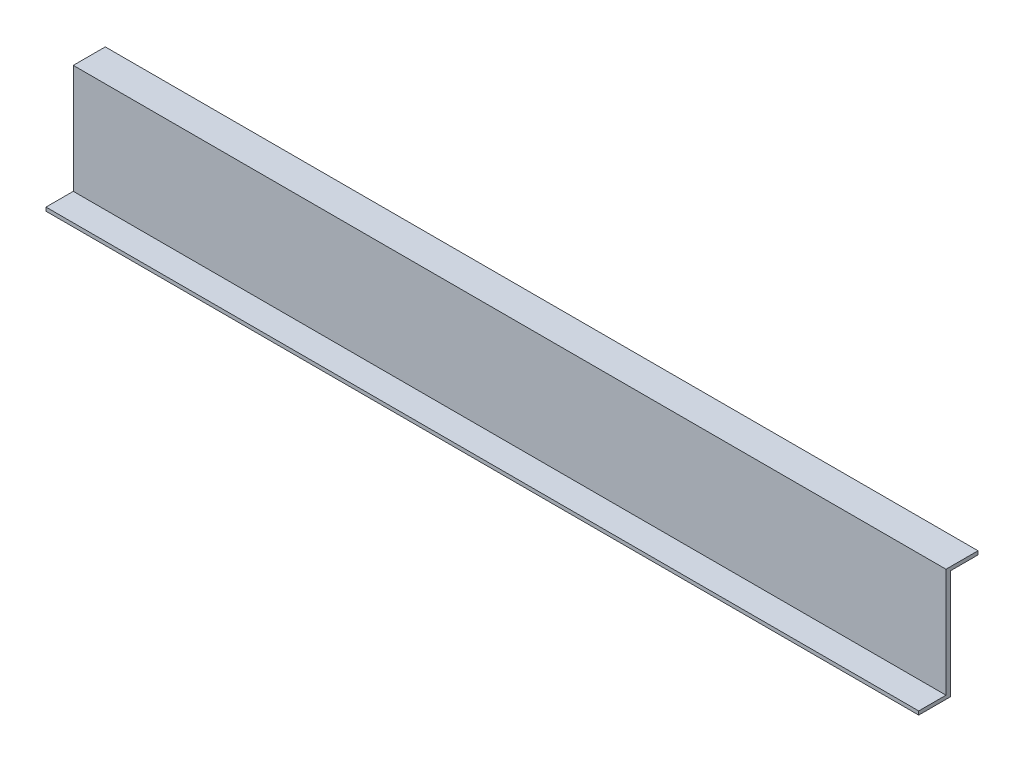
from build123d import *

# Parameters (mm, degrees)
SKETCH2_W           = 609.6
SKETCH2_H           = 78.74
BOSS_EXTRUDE1_DEPTH = 44.704
SKETCH4_W           = 19.05
SKETCH4_H           = 76.2
CUT_EXTRUDE1_DEPTH  = 617.287753583


with BuildPart() as part:
    # Sketch2 → Boss-Extrude1 (new body)
    with BuildSketch(Plane.XY):
        with Locations((304.8, 39.37)):
            Rectangle(SKETCH2_W, SKETCH2_H)
    extrude(amount=BOSS_EXTRUDE1_DEPTH)

    # Sketch4 → Cut-Extrude1 (cut, through all)
    with BuildSketch(Plane(origin=(609.6, 0, 0), x_dir=(0, 0, -1), z_dir=(1, 0, 0))):
        with Locations((-35.179, 40.64)):
            Rectangle(SKETCH4_W, SKETCH4_H)
        Polygon((0, 78.74), (-3.302, 78.74), (-3.302, 76.2), (-22.352, 76.2), (-22.352, 0), (0, 0), align=None)
    extrude(amount=-CUT_EXTRUDE1_DEPTH, mode=Mode.SUBTRACT)


solid = part.part
